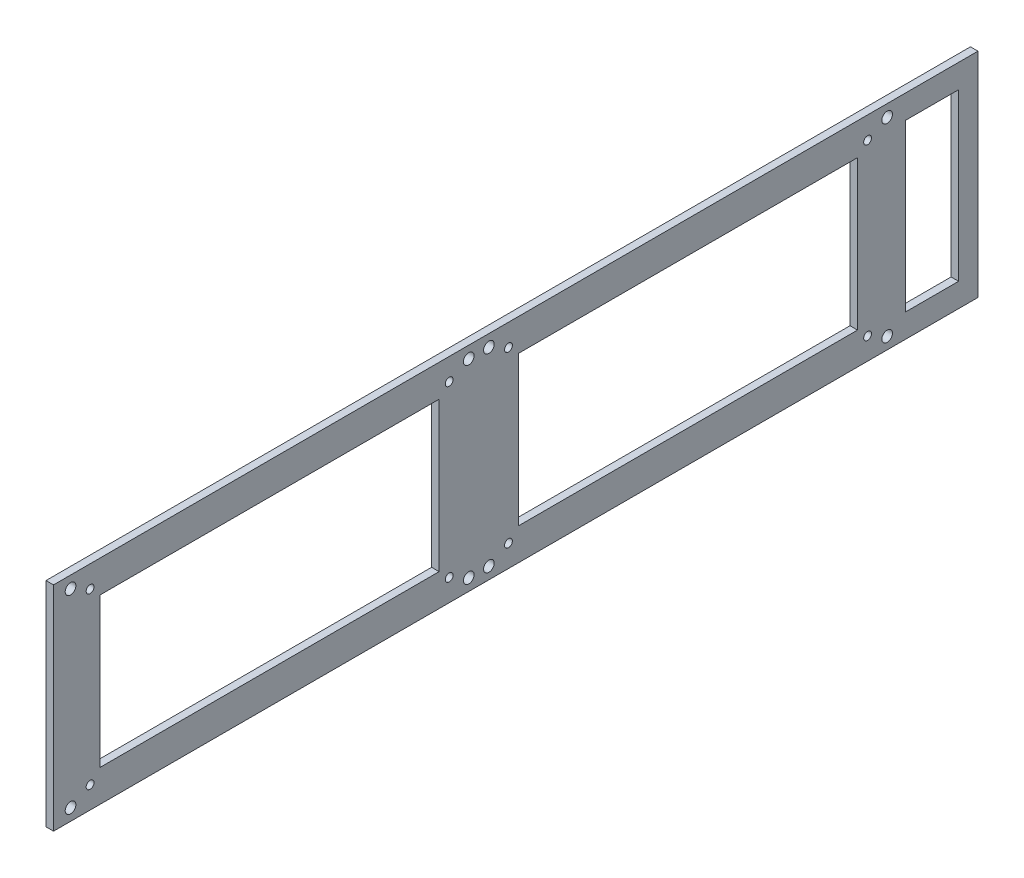
from build123d import *

# Parameters (mm, degrees)
SKETCH1_W             = 390
SKETCH1_H             = 90
BOSS_EXTRUDE1_DEPTH   = 3.175
SKETCH2_W             = 143
SKETCH2_H             = 63
CUT_EXTRUDE1_DEPTH    = 3.175
M4X0_7_TAPPED_HOLE1_D = 3.3
SKETCH6_W             = 22.475
SKETCH6_H             = 70
CUT_EXTRUDE2_DEPTH    = 3.175
M4_CLEARANCE_HOLE2_D  = 4.5


with BuildPart() as part:
    # Sketch1 → Boss-Extrude1 (new body)
    with BuildSketch(Plane(origin=(0, 0, 0), x_dir=(0, 0, -1), z_dir=(1, 0, 0))):
        Rectangle(SKETCH1_W, SKETCH1_H)
    extrude(amount=BOSS_EXTRUDE1_DEPTH)

    # Sketch2 → Cut-Extrude1 (cut)
    with BuildSketch(Plane(origin=(3.175, 0, 0), x_dir=(0, 0, -1), z_dir=(1, 0, 0))):
        with Locations((72.675, 0)):
            Rectangle(SKETCH2_W, SKETCH2_H)
        with Locations((-103.825, 0)):
            Rectangle(SKETCH2_W, SKETCH2_H)
    extrude(amount=-CUT_EXTRUDE1_DEPTH, mode=Mode.SUBTRACT)

    # M4x0.7 Tapped Hole1 (through all)
    with Locations(Plane(origin=(3.175, 0, 0), x_dir=(0, 0, -1), z_dir=(1, 0, 0))):
        with Locations((-103.825, 0), (-28.075, 35.75), (-179.575, -35.75), (-179.575, 35.75), (-28.075, -35.75), (72.675, 0), (148.425, 35.75), (-3.075, -35.75), (-3.075, 35.75), (148.425, -35.75)):
            Hole(M4X0_7_TAPPED_HOLE1_D / 2)

    # Sketch6 → Cut-Extrude2 (cut)
    with BuildSketch(Plane(origin=(3.175, 0, 0), x_dir=(0, 0, -1), z_dir=(1, 0, 0))):
        with Locations((175.5875, 0)):
            Rectangle(SKETCH6_W, SKETCH6_H)
    extrude(amount=-CUT_EXTRUDE2_DEPTH, mode=Mode.SUBTRACT)

    # M4 Clearance Hole2 (through all)
    with Locations(Plane(origin=(3.175, 0, 0), x_dir=(0, 0, -1), z_dir=(1, 0, 0))):
        with Locations((-103.825, 0), (-19.825, 40), (-187.825, -40), (-187.825, 40), (-19.825, -40), (72.675, 0), (156.675, 40), (-11.325, -40), (-11.325, 40), (156.675, -40)):
            Hole(M4_CLEARANCE_HOLE2_D / 2)


solid = part.part
